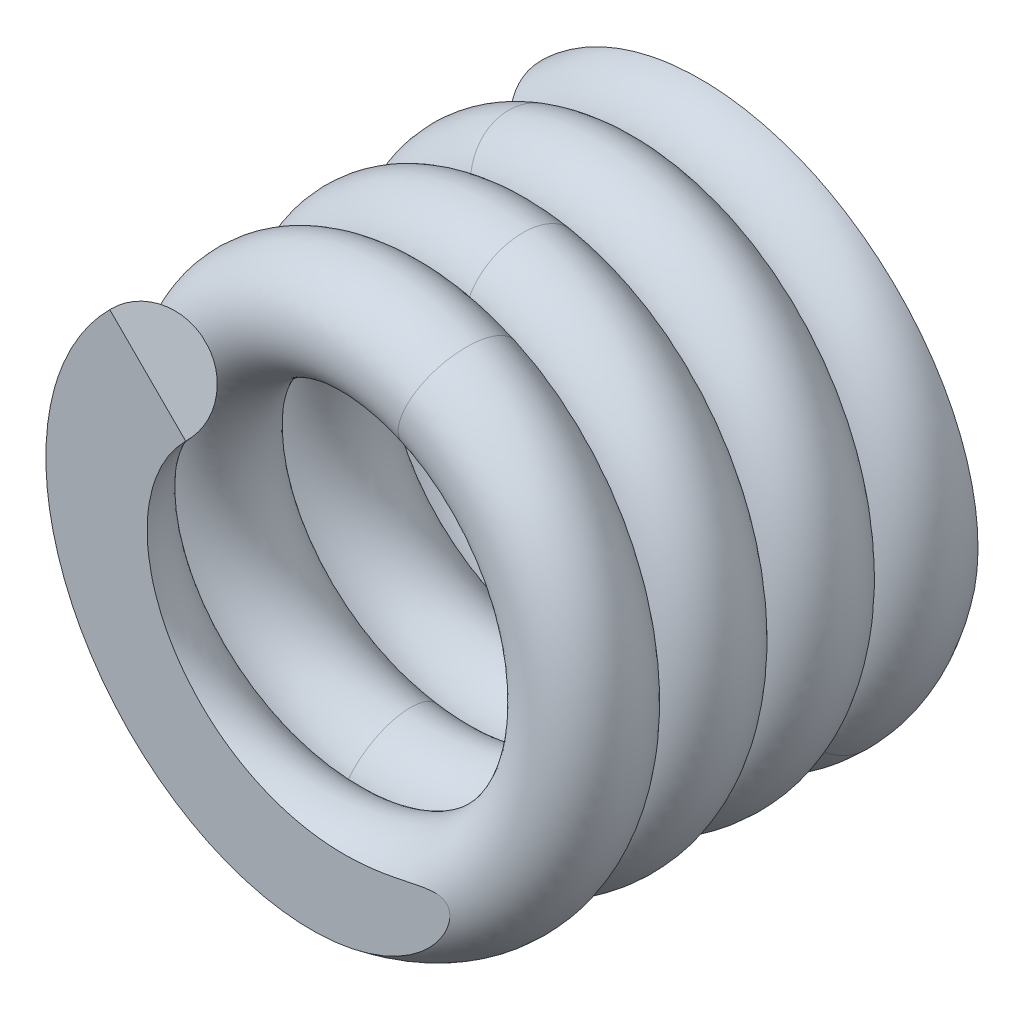
from build123d import *

# Parameters (mm, degrees)
SWEEP_1_PITCH            = 1.2
SWEEP_1_HEIGHT           = 4.8
SWEEP_1_RADIUS           = 2.4
SWEEP_1_START_ANGLE      = 135
SWEEP_1_PROFILE_R        = 0.6
CUT_EXTRUDE_1_DEPTH      = 8.083728731
CUT_EXTRUDE_1_DEPTH_BACK = 8.083728731
SKETCH_8_OUTSIDE_W       = 10.729
SKETCH_8_OUTSIDE_H       = 12.564
SKETCH_8_OUTSIDE_W_2     = 4.8
SKETCH_8_OUTSIDE_H_2     = 7.047514204


with BuildPart() as part:
    # 扫描1: sweep along a helix
    with BuildLine() as sweep_1_path:
        add(Helix(SWEEP_1_PITCH, SWEEP_1_HEIGHT, SWEEP_1_RADIUS, center=(0, 0, 0), direction=(0, 0, 1), lefthand=True, mode=Mode.PRIVATE).rotate(Axis((0, 0, 0), (0, 0, 1)), SWEEP_1_START_ANGLE))
    # 扫描1 profile (on start of the path) → 扫描1 (sweep)
    with BuildSketch(Plane(origin=(-1.697056275, 1.697056275, 0), x_dir=(0.7071067811866992, -0.7071067811863958, 0), z_dir=(0.7048784558941531, 0.7048784558944555, 0.07932669684363973))):
        Circle(SWEEP_1_PROFILE_R)
    sweep(path=sweep_1_path.line, is_frenet=True)

    # 草图8 outside → 切除-拉伸1 (cut, two sides: drawn at the far end of the back side and taken through both)
    with BuildSketch(Plane(origin=(0.268395262, 0.268395262, 0.030205079), x_dir=(0.056092445267283186, 0.056092445267277476, -0.9968486721503291), z_dir=(0.704878455894339, 0.7048784558942676, 0.07932669684365837)).offset(-CUT_EXTRUDE_1_DEPTH_BACK)):
        with Locations((-2.3925, 0)):
            Rectangle(SKETCH_8_OUTSIDE_W, SKETCH_8_OUTSIDE_H)
        with Locations((-2.4, 0.042381958)):
            Rectangle(SKETCH_8_OUTSIDE_W_2, SKETCH_8_OUTSIDE_H_2, mode=Mode.SUBTRACT)
    extrude(amount=CUT_EXTRUDE_1_DEPTH + CUT_EXTRUDE_1_DEPTH_BACK, mode=Mode.SUBTRACT)


solid = part.part
